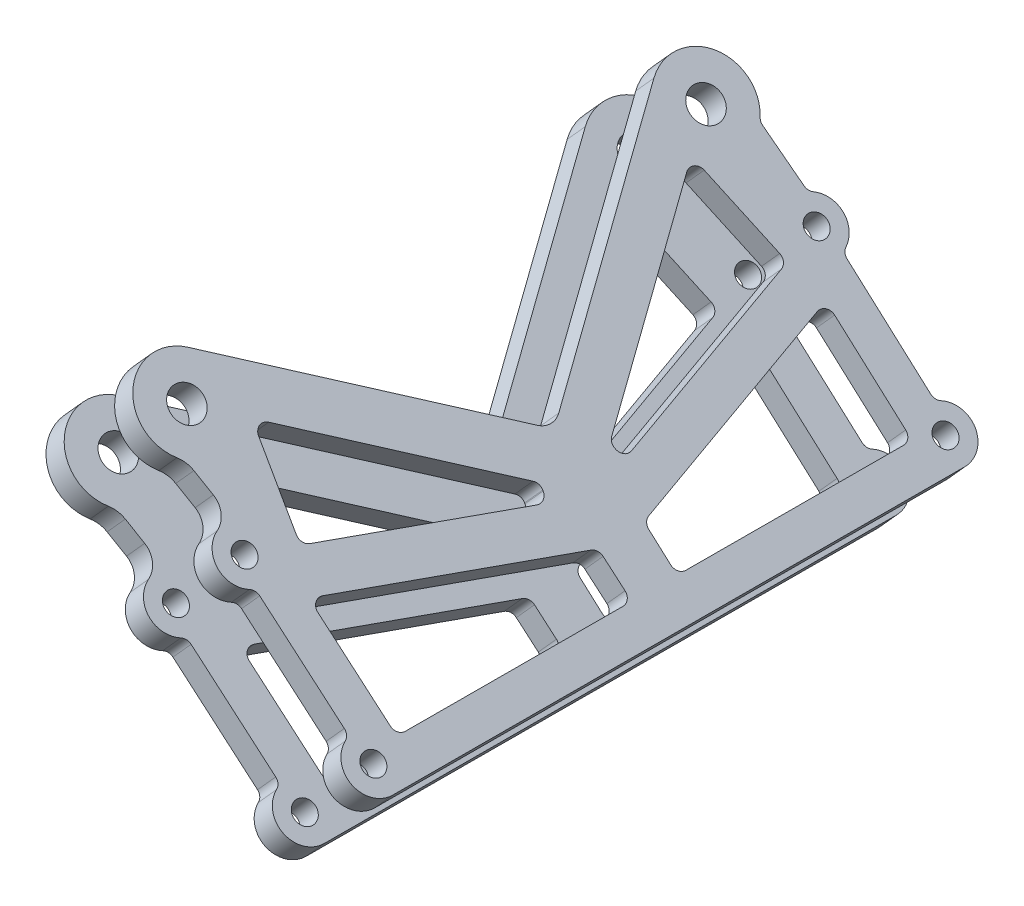
from build123d import *

# Parameters (mm, degrees)
BOSS_EXTRUDE1_DEPTH      = 18.9611
BOSS_EXTRUDE1_DEPTH_BACK = 18.9611
SKETCH1_R                = 4.7625
SKETCH1_R_2              = 3.175
CUT_EXTRUDE1_DEPTH       = 1690.991520952
CUT_EXTRUDE3_DEPTH       = 2192.092256482
CUT_EXTRUDE3_DEPTH_BACK  = 2192.092256482
CUT_EXTRUDE4_DEPTH       = 1679.262290601
CUT_EXTRUDE4_DEPTH_BACK  = 1679.262290601
SKETCH6_R                = 3.175
BOSS_EXTRUDE2_DEPTH      = 7.9375
SKETCH7_R                = 3.175
BOSS_EXTRUDE3_DEPTH      = 7.9375


with BuildPart() as part:
    # Sketch1 → Boss-Extrude1 (new, two sides: drawn at the far end of the back side and taken through both)
    with BuildSketch(Plane(origin=(1354.902567718, 1506.050225186, 0), x_dir=(-0.7434257201916812, 0.6688152893913332, -0.0020753876427315253), z_dir=(0.668816729767919, 0.7434273212510732, 0)).offset(-BOSS_EXTRUDE1_DEPTH_BACK)):
        Polygon((-1452.565866544, 536.622337583), (-1474.155866544, 558.212337583), (-1575.755866544, 558.212337583), (-1575.755866544, 363.303741466), (-1473.840970212, 363.303741466), (-1452.565866544, 384.937895648), align=None)
        with Locations(Location((-1474.155866544, 536.622337583, 0), (0, 0, 0.118911038))):
            Circle(SKETCH1_R, mode=Mode.SUBTRACT)
        with Locations(Location((-1473.840970212, 384.893741466, 0), (0, 0, 0.118911038))):
            Circle(SKETCH1_R, mode=Mode.SUBTRACT)
        with Locations(Location((-1557.975866544, 544.242337583, 0), (0, 0, 0.118911038))):
            Circle(SKETCH1_R_2, mode=Mode.SUBTRACT)
        with Locations(Location((-1507.175866544, 544.242337583, 0), (0, 0, 0.118911038))):
            Circle(SKETCH1_R_2, mode=Mode.SUBTRACT)
        with Locations(Location((-1507.175866544, 377.273741466, 0), (0, 0, 180.118911038))):
            Circle(SKETCH1_R_2, mode=Mode.SUBTRACT)
        with Locations(Location((-1557.975866544, 377.273741466, 0), (0, 0, 180.118911038))):
            Circle(SKETCH1_R_2, mode=Mode.SUBTRACT)
        with Locations(Location((-1532.575866544, 460.758039525, 0), (0, 0, 0.118911038))):
            Circle(SKETCH1_R_2, mode=Mode.SUBTRACT)
    extrude(amount=BOSS_EXTRUDE1_DEPTH + BOSS_EXTRUDE1_DEPTH_BACK)

    # Sketch2 → Cut-Extrude1 (cut, through all)
    # profile 1 of 3: a face of its own
    with BuildSketch(Plane(origin=(1367.584068613, 1520.146424967, 0), x_dir=(0.743427321251074, -0.6688167297679183, 0), z_dir=(0.6688167297679183, 0.743427321251074, 0))):
        Polygon((1472.994184786, -561.270580275), (1574.593965978, -561.48143966), (1574.99847687, -366.573263301), (1473.083800024, -366.361750385), (1451.763842918, -387.951703888), (1451.449038902, -539.635819153), align=None)
        with BuildLine():
            ThreePointArc((1550.49307944, -376.870118158), (1559.065356173, -373.120830393), (1564.809521996, -380.506332823))
            Line((1564.809521996, -380.506332823), (1564.462997435, -547.474569354))
            ThreePointArc((1564.462997435, -547.474569354), (1558.414543492, -554.930750882), (1549.871227622, -550.550089744))
            ThreePointArc((1549.871227622, -550.550089744), (1548.916640649, -549.435983399), (1547.505197353, -549.035612247))
            Line((1547.505197353, -549.035612247), (1514.984743948, -549.574796048))
            ThreePointArc((1514.984743948, -549.574796048), (1513.697694534, -549.949974039), (1512.780914919, -550.928120171))
            ThreePointArc((1512.780914919, -550.928120171), (1505.596393214, -554.976034359), (1498.935046628, -550.115023862))
            ThreePointArc((1498.935046628, -550.115023862), (1496.209630616, -546.917323775), (1492.084145404, -546.12136521))
            Line((1492.084145404, -546.12136521), (1485.722601127, -547.060643016))
            ThreePointArc((1485.722601127, -547.060643016), (1483.545404785, -547.725863827), (1481.661886143, -549.004558539))
            ThreePointArc((1481.661886143, -549.004558539), (1464.462735016, -549.04747305), (1462.992800513, -531.911197677))
            Line((1462.992800513, -531.911197677), (1513.162301247, -467.03996643))
            ThreePointArc((1513.162301247, -467.03996643), (1514.223822597, -463.936581219), (1513.167662188, -460.831367453))
            Line((1513.167662188, -460.831367453), (1462.980767275, -395.705548563))
            ThreePointArc((1462.980767275, -395.705548563), (1464.138735479, -378.892154967), (1480.970023273, -378.032593577))
            ThreePointArc((1480.970023273, -378.032593577), (1481.784959595, -378.468842343), (1482.702041018, -378.584582822))
            Line((1482.702041018, -378.584582822), (1497.819801775, -377.715297145))
            ThreePointArc((1497.819801775, -377.715297145), (1498.989128615, -377.352504696), (1499.852900503, -376.484840161))
            ThreePointArc((1499.852900503, -376.484840161), (1506.595572703, -372.783686567), (1513.128410071, -376.843760735))
            ThreePointArc((1513.128410071, -376.843760735), (1514.063203634, -377.833283819), (1515.374669628, -378.198046603))
            Line((1515.374669628, -378.198046603), (1548.260931921, -378.198046603))
            ThreePointArc((1548.260931921, -378.198046603), (1549.559573182, -377.840964575), (1550.49307944, -376.870118158))
        make_face(mode=Mode.SUBTRACT)
    # profile 2 of 3: a face of its own
    with BuildSketch(Plane(origin=(1367.584068613, 1520.146424967, 0), x_dir=(0.743427321251074, -0.6688167297679183, 0), z_dir=(0.6688167297679183, 0.743427321251074, 0))):
        with BuildLine():
            Line((1525.366370079, -453.419835253), (1525.584651122, -453.370415011))
            ThreePointArc((1525.584651122, -453.370415011), (1527.218591418, -452.171542446), (1527.455322083, -450.158829126))
            Line((1527.455322083, -450.158829126), (1510.413049442, -393.724240222))
            ThreePointArc((1510.413049442, -393.724240222), (1509.259929435, -392.263708579), (1507.420624768, -391.981225356))
            Line((1507.420624768, -391.981225356), (1484.671808017, -397.131704865))
            ThreePointArc((1484.671808017, -397.131704865), (1482.842956269, -398.748309476), (1483.221039847, -401.159774175))
            Line((1483.221039847, -401.159774175), (1522.793848196, -452.493303812))
            ThreePointArc((1522.793848196, -452.493303812), (1523.944797458, -453.332263482), (1525.366370079, -453.419835253))
        make_face()
    # profile 3 of 3: a face of its own
    with BuildSketch(Plane(origin=(1367.584068613, 1520.146424967, 0), x_dir=(0.743427321251074, -0.6688167297679183, 0), z_dir=(0.6688167297679183, 0.743427321251074, 0))):
        with BuildLine():
            Line((1527.36885489, -477.794875915), (1510.808419922, -531.822526784))
            ThreePointArc((1510.808419922, -531.822526784), (1509.64696895, -533.279572519), (1507.803662493, -533.551917777))
            Line((1507.803662493, -533.551917777), (1486.215868995, -528.522907563))
            ThreePointArc((1486.215868995, -528.522907563), (1484.399092253, -526.900547596), (1484.782909022, -524.495258781))
            Line((1484.782909022, -524.495258781), (1522.715809258, -475.44645608))
            ThreePointArc((1522.715809258, -475.44645608), (1523.873644641, -474.607286752), (1525.301326042, -474.526578936))
            Line((1525.301326042, -474.526578936), (1525.516654272, -474.576740981))
            ThreePointArc((1525.516654272, -474.576740981), (1527.141793572, -475.783475892), (1527.36885489, -477.794875915))
        make_face()
    extrude(amount=-CUT_EXTRUDE1_DEPTH, mode=Mode.SUBTRACT)

    # Sketch3 → Cut-Extrude3 (cut, two sides: drawn at the far end of the back side and taken through both)
    with BuildSketch(Plane(origin=(871.939571673, -784.431451753, 907.058941138), x_dir=(-0.8088029071550414, -0.3846789648591811, 0.4448145134462481), z_dir=(-0.588079805279482, 0.5290599376246815, -0.6117660705065414)).offset(-CUT_EXTRUDE3_DEPTH_BACK)):
        Polygon((-1938.964429722, 770.867869691), (-1920.733120124, 758.470354692), (-2049.777089537, 568.70324747), (-2068.008399135, 581.100762469), align=None)
    extrude(amount=CUT_EXTRUDE3_DEPTH + CUT_EXTRUDE3_DEPTH_BACK, mode=Mode.SUBTRACT)


with BuildPart() as cut_extrude3_piece_1:
    # of the separate pieces the step leaves, piece 1, a body of its own (cut_extrude3_pieces)
    add(part.part.solids().sort_by_distance((2448.523376871, 507.357451917, 378.032593577))[0])


with BuildPart() as cut_extrude3_piece_2:
    # of the separate pieces the step leaves, piece 2, a body of its own (cut_extrude3_pieces)
    add(part.part.solids().sort_by_distance((2468.577645868, 529.648897117, 378.032593577))[0])


with BuildPart() as cut_extrude4_tool:
    # Sketch4 → Cut-Extrude4 (new, two sides: drawn at the far end of the back side and taken through both)
    with BuildSketch(Plane(origin=(1367.584068613, 1520.146424967, 0), x_dir=(0.743427321251074, -0.6688167297679183, 0), z_dir=(0.6688167297679183, 0.743427321251074, 0)).offset(-CUT_EXTRUDE4_DEPTH_BACK)):
        with BuildLine():
            Line((1524.152679291, -388.358046603), (1552.087927764, -388.358046603))
            ThreePointArc((1552.087927764, -388.358046603), (1553.885841773, -389.103860098), (1554.627922294, -390.903318087))
            Line((1554.627922294, -390.903318087), (1554.496134895, -454.403318087))
            ThreePointArc((1554.496134895, -454.403318087), (1553.75032687, -456.195960612), (1551.956140365, -456.938046603))
            Line((1551.956140365, -456.938046603), (1543.328584242, -456.938046603))
            ThreePointArc((1543.328584242, -456.938046603), (1541.814233753, -456.437248063), (1540.897036424, -455.132332112))
            Line((1540.897036424, -455.132332112), (1521.721131473, -391.632332112))
            ThreePointArc((1521.721131473, -391.632332112), (1522.113477831, -389.383696114), (1524.152679291, -388.358046603))
        make_face()
        with BuildLine():
            Line((1523.959379291, -539.264601711), (1551.828345717, -538.802538804))
            ThreePointArc((1551.828345717, -538.802538804), (1553.595266609, -538.045867959), (1554.326233249, -536.268159328))
            Line((1554.326233249, -536.268159328), (1554.458018836, -472.769032334))
            ThreePointArc((1554.458018836, -472.769032334), (1553.701004422, -470.95473296), (1551.875917309, -470.224109889))
            Line((1551.875917309, -470.224109889), (1543.437522434, -470.364017097))
            ThreePointArc((1543.437522434, -470.364017097), (1541.952637131, -470.873915729), (1541.051150408, -472.159296086))
            Line((1541.051150408, -472.159296086), (1521.488793269, -535.98057878))
            ThreePointArc((1521.488793269, -535.98057878), (1521.887519965, -538.251943051), (1523.959379291, -539.264601711))
        make_face()
    extrude(amount=CUT_EXTRUDE4_DEPTH + CUT_EXTRUDE4_DEPTH_BACK)


with BuildPart() as cut_extrude3_piece_1_1:
    add(cut_extrude3_piece_1.part)

    # Cut-Extrude4: cut by cut_extrude4_tool
    add(cut_extrude4_tool.part, mode=Mode.SUBTRACT)

    # Sketch7 → Boss-Extrude3 (add)
    with BuildSketch(Plane(origin=(1342.221066823, 1491.954025405, 0), x_dir=(0.743427321251074, -0.6688167297679183, 0), z_dir=(-0.6688167297679183, -0.743427321251074, 0))):
        with Locations((1531.616314417, 463.937736242)):
            Circle(SKETCH7_R)
    extrude(amount=-BOSS_EXTRUDE3_DEPTH)


with BuildPart() as cut_extrude3_piece_2_1:
    add(cut_extrude3_piece_2.part)

    # Cut-Extrude4: cut by cut_extrude4_tool
    add(cut_extrude4_tool.part, mode=Mode.SUBTRACT)

    # Sketch6 → Boss-Extrude2 (add)
    with BuildSketch(Plane(origin=(1367.584068613, 1520.146424967, 0), x_dir=(0.743427321251074, -0.6688167297679183, 0), z_dir=(0.6688167297679183, 0.743427321251074, 0))):
        with Locations(Location((1531.616314417, -463.937736242, 0), (0, 0, 180))):
            Circle(SKETCH6_R)
    extrude(amount=-BOSS_EXTRUDE2_DEPTH)


solid = Compound([cut_extrude3_piece_1_1.part, cut_extrude3_piece_2_1.part])
